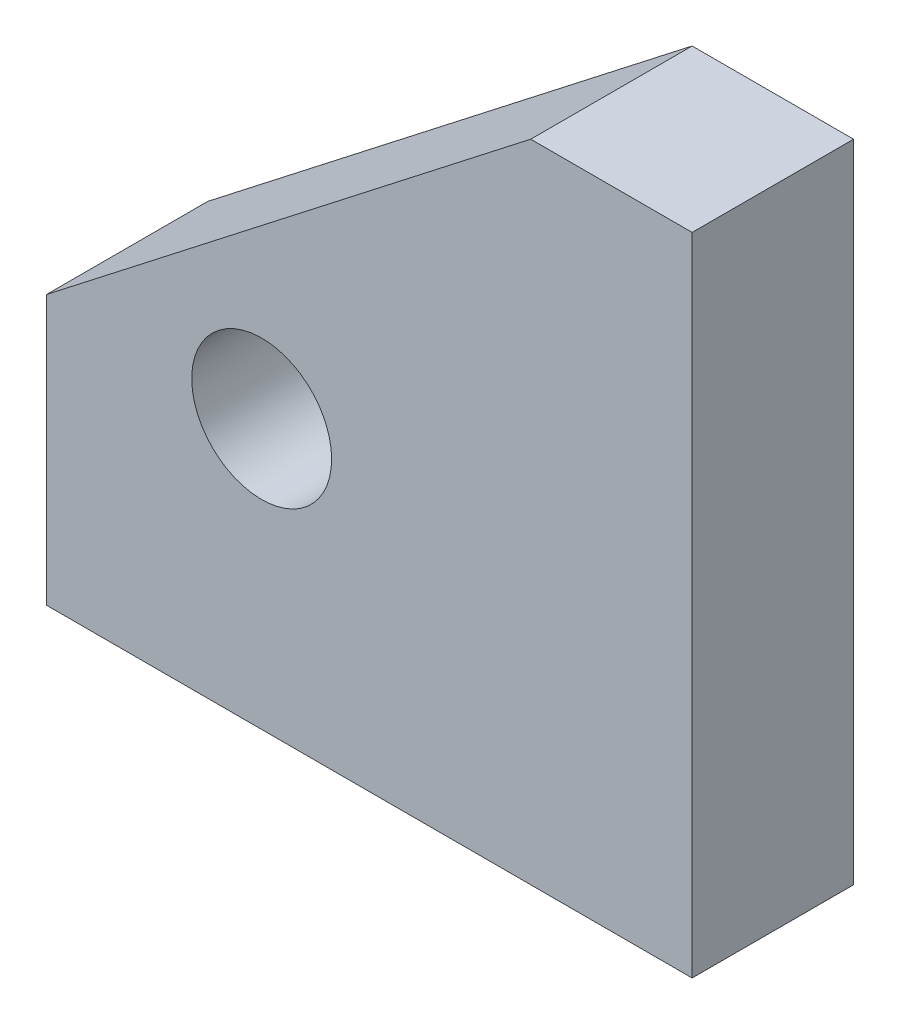
from build123d import *

# Parameters (mm, degrees)
SKETCH1_R           = 6.5
BOSS_EXTRUDE2_DEPTH = 15


with BuildPart() as part:
    # Sketch1 → Boss-Extrude2 (new body)
    with BuildSketch(Plane(origin=(0, 0, 0), x_dir=(0, 1, 0), z_dir=(0, 0, 1))):
        Polygon((0, 60), (0, 0), (60, 0), (60, 15), (25, 60), align=None)
        with Locations(Location((25, 40, 0), (0, 0, 270))):
            Circle(SKETCH1_R, mode=Mode.SUBTRACT)
    extrude(amount=-BOSS_EXTRUDE2_DEPTH)


solid = part.part
